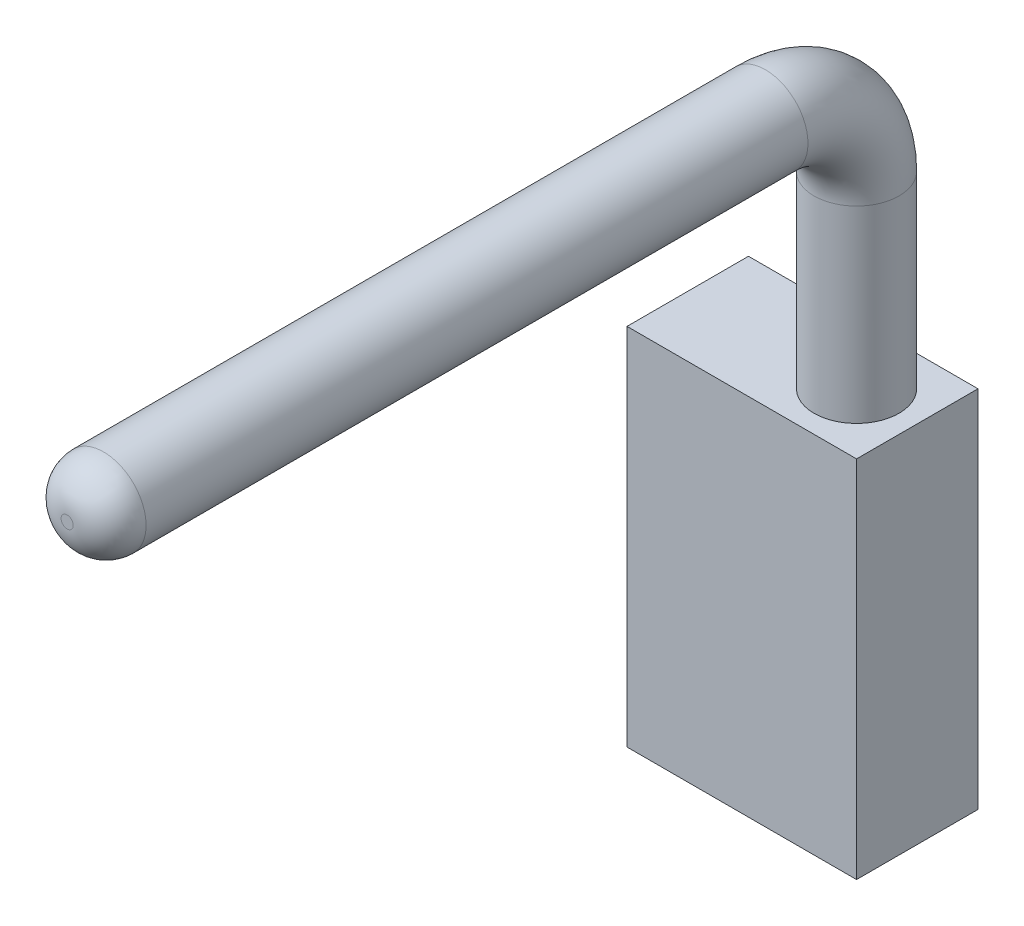
from build123d import *

# Parameters (mm, degrees)
SKETCH1_W           = 38.1
SKETCH1_H           = 24.003
BOSS_EXTRUDE1_DEPTH = 12.7
SKETCH3_R           = 4.445
FILLET1_R           = 3.81


with BuildPart() as part:
    # Sketch1 → Boss-Extrude1 (new body)
    with BuildSketch(Plane(origin=(0, 0, 0), x_dir=(0, 1, 0), z_dir=(0, 0, 1))):
        Rectangle(SKETCH1_W, SKETCH1_H)
    extrude(amount=BOSS_EXTRUDE1_DEPTH)

    # Sweep1: sweep along a path in Sketch2
    with BuildLine(Plane(origin=(5.6515, 0, 0), x_dir=(0, 0, -1), z_dir=(1, 0, 0))) as sweep1_path:
        Line((-6.35, 19.05), (-6.35, 38.735))
        ThreePointArc((-6.35, 38.735), (-9.139807909, 45.470192091), (-15.875, 48.26))
        Line((-15.875, 48.26), (-88.9, 48.26))
    # Sketch3 → Sweep1 (sweep)
    with BuildSketch(Plane(origin=(0, 19.05, 0), x_dir=(-1, 0, 0), z_dir=(0, 1, 0))):
        with Locations((-5.6515, 6.35)):
            Circle(SKETCH3_R)
    sweep(path=sweep1_path.line)

    # Fillet1
    fillet1_edges = [part.edges().sort_by_distance(p)[0] for p in [
        (10.0965, 48.26, 88.9),
    ]]
    fillet(fillet1_edges, radius=FILLET1_R)


solid = part.part
